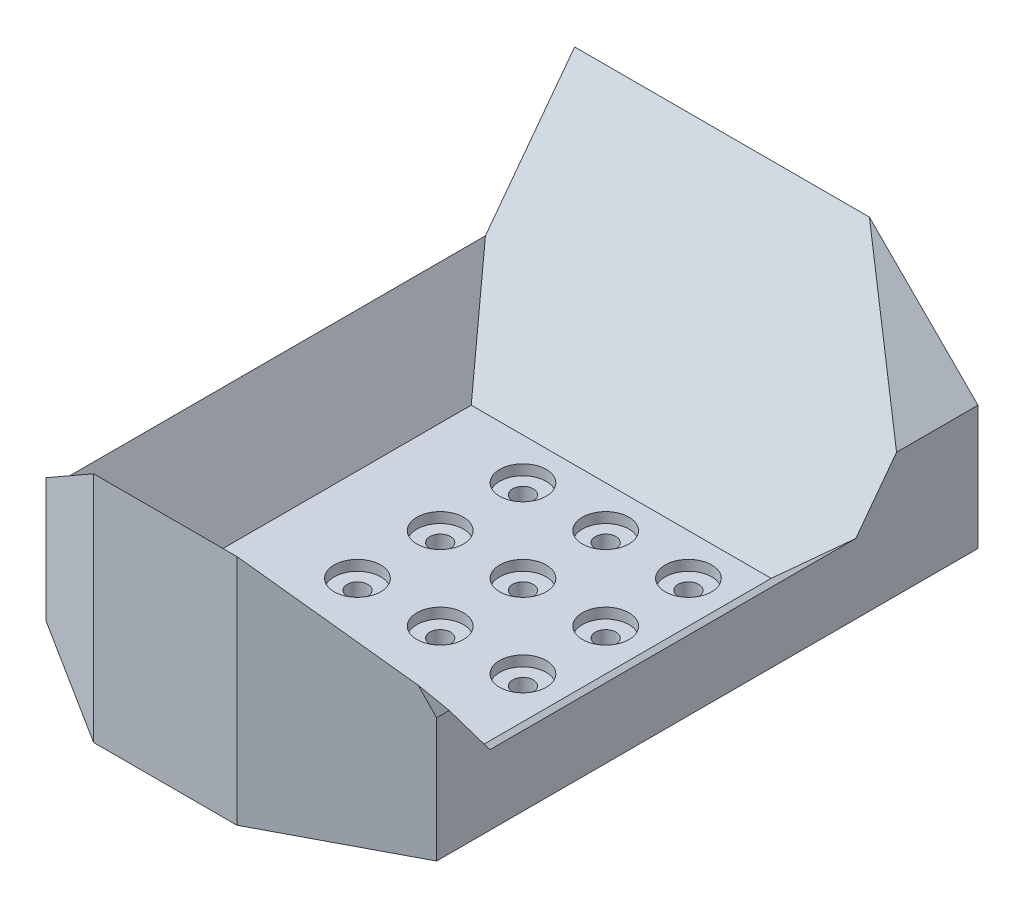
from build123d import *
from build123d.topology import SkipClean

# Parameters (mm, degrees)
SKETCH_1_W           = 62
SKETCH_1_H           = 62
EXTRUDE_1_DEPTH      = 19
SKETCH_4_W           = 58
SKETCH_4_H           = 58
CUT_EXTRUDE_1_DEPTH  = 17
SKETCH_5_W           = 8
SKETCH_5_H           = 62
EXTRUDE_2_DEPTH      = 19
SKETCH_7_W           = 58
SKETCH_7_H           = 17
CUT_EXTRUDE_2_DEPTH  = 19
CUT_EXTRUDE_3_DEPTH  = 108
SKETCH_9_W           = 70
SKETCH_9_H           = 2
EXTRUDE_3_DEPTH      = 28
SKETCH_10_W          = 70
SKETCH_10_H          = 28
EXTRUDE_4_DEPTH      = 40
CUT_EXTRUDE_5_DEPTH  = 90
SKETCH_14_W          = 60
SKETCH_14_H          = 62
CUT_EXTRUDE_6_DEPTH  = 17
SKETCH_15_W          = 62
SKETCH_15_H          = 2
EXTRUDE_6_DEPTH      = 8
SKETCH_18_W          = 10
SKETCH_18_H          = 62
EXTRUDE_8_DEPTH      = 19
CUT_EXTRUDE_7_DEPTH  = 62
EXTRUDE_9_DEPTH      = 8
SKETCH_23_W          = 78
SKETCH_23_H          = 2
EXTRUDE_13_DEPTH     = 28
SKETCH_25_W          = 78
SKETCH_25_H          = 28
EXTRUDE_14_DEPTH     = 40
CUT_EXTRUDE_8_DEPTH  = 99
EXTRUDE_19_DEPTH     = 78
EXTRUDE_20_DEPTH     = 78
EXTRUDE_21_DEPTH     = 24
EXTRUDE_22_DEPTH     = 24
EXTRUDE_23_DEPTH     = 24
EXTRUDE_24_DEPTH     = 24
SKETCH_43_W          = 78
SKETCH_43_H          = 118
EXTRUDE_25_DEPTH     = 1
CUT_EXTRUDE_14_DEPTH = 127
CUT_EXTRUDE_15_DEPTH = 80
SKETCH_49_R          = 2
CUT_EXTRUDE_17_DEPTH = 19
SKETCH_50_R          = 4.5
CUT_EXTRUDE_18_DEPTH = 2
SKETCH_55_R          = 2
CUT_EXTRUDE_20_DEPTH = 7.5
SKETCH_57_W          = 36.095465849
SKETCH_57_H          = 32.16378967
EXTRUDE_26_DEPTH     = 7
SKETCH_63_R          = 1.8
CUT_EXTRUDE_23_DEPTH = 7.5
SKETCH_64_W          = 78
SKETCH_64_H          = 118
EXTRUDE_27_DEPTH     = 1
SKETCH_65_R          = 2
CUT_EXTRUDE_24_DEPTH = 29
SKETCH_66_W          = 78
SKETCH_66_H          = 118
EXTRUDE_28_DEPTH     = 1
SKETCH_68_R          = 2
CUT_EXTRUDE_25_DEPTH = 28
CUT_EXTRUDE_26_DEPTH = 123.576506721
SKETCH_70_R          = 4
CUT_EXTRUDE_27_DEPTH = 5.5
CUT_EXTRUDE_28_REACH = 145.485


with BuildPart() as part:
    # 草圖1 → 填料-伸長1 (new body)
    with BuildSketch(Plane(origin=(0, 0, 0), x_dir=(1, 0, 0), z_dir=(0, 1, 0))):
        with Locations((31, 31)):
            Rectangle(SKETCH_1_W, SKETCH_1_H)
    extrude(amount=EXTRUDE_1_DEPTH)

    # 草圖4 → 除料-伸長1 (cut)
    with BuildSketch(Plane(origin=(0, 19, 0), x_dir=(1, 0, 0), z_dir=(0, 1, 0))):
        with Locations((31, 31)):
            Rectangle(SKETCH_4_W, SKETCH_4_H)
    extrude(amount=-CUT_EXTRUDE_1_DEPTH, mode=Mode.SUBTRACT)

    # 草圖5 → 填料-伸長2 (add)
    with BuildSketch(Plane(origin=(0, 19, 0), x_dir=(1, 0, 0), z_dir=(0, 1, 0))):
        with Locations((-4, 31)):
            Rectangle(SKETCH_5_W, SKETCH_5_H)
    extrude(amount=-EXTRUDE_2_DEPTH)

    # 草圖7 → 除料-伸長2 (cut)
    with BuildSketch(Plane.XY.offset(-60)):
        with Locations((31, 10.5)):
            Rectangle(SKETCH_7_W, SKETCH_7_H)
    extrude(amount=-CUT_EXTRUDE_2_DEPTH, mode=Mode.SUBTRACT)

    # 草圖8 → 除料-伸長3 (cut)
    with BuildSketch(Plane(origin=(0, 0, -62), x_dir=(-1, 0, 0), z_dir=(0, 0, -1))):
        Polygon((-2, 2), (8, 19), (-2, 19), align=None)
    extrude(amount=-CUT_EXTRUDE_3_DEPTH, mode=Mode.SUBTRACT)

    # 草圖9 → 填料-伸長3 (add)
    with BuildSketch(Plane(origin=(0, 0, -62), x_dir=(-1, 0, 0), z_dir=(0, 0, -1))):
        with Locations((-27, 1)):
            Rectangle(SKETCH_9_W, SKETCH_9_H)
    extrude(amount=EXTRUDE_3_DEPTH)

    # 草圖10 → 填料-伸長4 (add)
    with BuildSketch(Plane(origin=(0, 2, 0), x_dir=(1, 0, 0), z_dir=(0, 1, 0))):
        with Locations((27, 76)):
            Rectangle(SKETCH_10_W, SKETCH_10_H)
    extrude(amount=EXTRUDE_4_DEPTH)

    # 草圖11 → 除料-伸長5 (cut)
    with BuildSketch(Plane.ZY.offset(8)):
        Polygon((-62, 42), (-62, 2), (-90, 42), align=None)
    extrude(amount=-CUT_EXTRUDE_5_DEPTH, mode=Mode.SUBTRACT)

    # 草圖14 → 除料-伸長6 (cut)
    with BuildSketch(Plane(origin=(0, 19, 0), x_dir=(1, 0, 0), z_dir=(0, 1, 0))):
        with Locations((32, 31)):
            Rectangle(SKETCH_14_W, SKETCH_14_H)
    extrude(amount=-CUT_EXTRUDE_6_DEPTH, mode=Mode.SUBTRACT)

    # 草圖15 → 填料-伸長6 (add)
    with BuildSketch(Plane(origin=(62, 0, 0), x_dir=(0, 0, -1), z_dir=(1, 0, 0))):
        with Locations((31, 1)):
            Rectangle(SKETCH_15_W, SKETCH_15_H)
    extrude(amount=EXTRUDE_6_DEPTH)

    # 草圖18 → 填料-伸長8 (add)
    with BuildSketch(Plane(origin=(0, 2, 0), x_dir=(1, 0, 0), z_dir=(0, 1, 0))):
        with Locations((65, 31)):
            Rectangle(SKETCH_18_W, SKETCH_18_H)
    extrude(amount=EXTRUDE_8_DEPTH)

    # 草圖19 → 除料-伸長7 (cut)
    with BuildSketch(Plane.XY):
        Polygon((60, 2), (70, 10.5), (70, 21), (60, 21), align=None)
    extrude(amount=-CUT_EXTRUDE_7_DEPTH, mode=Mode.SUBTRACT)

    # 草圖20 → 填料-伸長9 (add)
    with BuildSketch(Plane(origin=(62, 0, 0), x_dir=(0, 0, -1), z_dir=(1, 0, 0))):
        Polygon((90, 42), (62, 2), (62, 0), (90, 0), align=None)
    extrude(amount=EXTRUDE_9_DEPTH)

    # 草圖23 → 填料-伸長13 (add)
    with BuildSketch(Plane.XY):
        with Locations((31, 1)):
            Rectangle(SKETCH_23_W, SKETCH_23_H)
    extrude(amount=EXTRUDE_13_DEPTH)

    # 草圖25 → 填料-伸長14 (add)
    with BuildSketch(Plane(origin=(0, 2, 0), x_dir=(1, 0, 0), z_dir=(0, 1, 0))):
        with Locations((31, -14)):
            Rectangle(SKETCH_25_W, SKETCH_25_H)
    extrude(amount=EXTRUDE_14_DEPTH)

    # 草圖26 → 除料-伸長8 (cut)
    with BuildSketch(Plane.ZY.offset(8)):
        Polygon((28, 42), (0, 42), (0, 2), align=None)
    extrude(amount=-CUT_EXTRUDE_8_DEPTH, mode=Mode.SUBTRACT)

    # 草圖34 → 填料-伸長19 (add)
    with BuildSketch(Plane(origin=(70, 0, 0), x_dir=(0, 0, -1), z_dir=(1, 0, 0))):
        Polygon((-28, 2), (0, 2), (-28, 42), align=None)
        Polygon((-28, 42), (0, 2), (0, 4.666666667), align=None)
        Polygon((0, 4.666666667), (0, 2), (2, 2), align=None)
    extrude(amount=-EXTRUDE_19_DEPTH)

    # 草圖36 → 填料-伸長20 (add)
    with BuildSketch(Plane.ZY.offset(8)):
        Polygon((-90, 2), (-62, 2), (-90, 42), align=None)
        Polygon((-90, 42), (-62, 2), (-62, 4.666666667), align=None)
        Polygon((-62, 4.666666667), (-62, 2), (-60, 2), align=None)
    extrude(amount=-EXTRUDE_20_DEPTH)

    # 草圖37 → 填料-伸長21 (add)
    with BuildSketch(Plane(origin=(0, 0, -62), x_dir=(-1, 0, 0), z_dir=(0, 0, -1))):
        Polygon((8, 4.666666667), (-0.431372549, 4.666666667), (8, 19), align=None)
    extrude(amount=EXTRUDE_21_DEPTH)

    # 草圖38 → 填料-伸長22 (add)
    with BuildSketch(Plane(origin=(0, 0, -62), x_dir=(-1, 0, 0), z_dir=(0, 0, -1))):
        Polygon((-63.137254902, 4.666666667), (-70, 4.666666667), (-70, 10.5), align=None)
    extrude(amount=EXTRUDE_22_DEPTH)

    # 草圖39 → 填料-伸長23 (add)
    with BuildSketch(Plane.XY):
        Polygon((-8, 19), (-8, 4.666666667), (0.431372549, 4.666666667), align=None)
    extrude(amount=EXTRUDE_23_DEPTH)

    # 草圖40 → 填料-伸長24 (add)
    with BuildSketch(Plane.XY):
        Polygon((70, 10.5), (63.137254902, 4.666666667), (70, 4.666666667), align=None)
    extrude(amount=EXTRUDE_24_DEPTH)

    # 草圖43 → 填料-伸長25 (add)
    with BuildSketch(Plane(origin=(0, 0, 0), x_dir=(-1, 0, 0), z_dir=(0, -1, 0))):
        with Locations((-31, 31)):
            Rectangle(SKETCH_43_W, SKETCH_43_H)
    extrude(amount=EXTRUDE_25_DEPTH)

    # 草圖46 → 除料-伸長14 (cut)
    with BuildSketch(Plane(origin=(0, 0, -90), x_dir=(-1, 0, 0), z_dir=(0, 0, -1))):
        Polygon((-70, 42), (-60, 42), (-70, 21), align=None)
    extrude(amount=-CUT_EXTRUDE_14_DEPTH, mode=Mode.SUBTRACT)

    # 草圖47 → 除料-伸長15 (cut)
    with BuildSketch(Plane.XY.offset(28)):
        Polygon((-8, 42), (2, 42), (-8, 21), align=None)
    extrude(amount=-CUT_EXTRUDE_15_DEPTH, mode=Mode.SUBTRACT)

    # 草圖49 → 除料-伸長17 (cut)
    with BuildSketch(Plane(origin=(0, 2, 0), x_dir=(1, 0, 0), z_dir=(0, 1, 0))):
        with Locations(Location((52, 52, 0), (0, 0, 270))):
            Circle(SKETCH_49_R)
        with Locations(Location((36, 52, 0), (0, 0, 270))):
            Circle(SKETCH_49_R)
        with Locations(Location((20, 52, 0), (0, 0, 270))):
            Circle(SKETCH_49_R)
        with Locations(Location((36, 36, 0), (0, 0, 270))):
            Circle(SKETCH_49_R)
        with Locations(Location((20, 36, 0), (0, 0, 270))):
            Circle(SKETCH_49_R)
        with Locations(Location((36, 20, 0), (0, 0, 270))):
            Circle(SKETCH_49_R)
        with Locations(Location((20, 20, 0), (0, 0, 270))):
            Circle(SKETCH_49_R)
        with Locations(Location((52, 36, 0), (0, 0, 270))):
            Circle(SKETCH_49_R)
        with Locations(Location((52, 20, 0), (0, 0, 270))):
            Circle(SKETCH_49_R)
    extrude(amount=-CUT_EXTRUDE_17_DEPTH, mode=Mode.SUBTRACT)

    # 草圖50 → 除料-伸長18 (cut)
    with BuildSketch(Plane(origin=(0, 2, 0), x_dir=(1, 0, 0), z_dir=(0, 1, 0))):
        with Locations(Location((52, 20, 0), (0, 0, 270))):
            Circle(SKETCH_50_R)
        with Locations(Location((36, 20, 0), (0, 0, 270))):
            Circle(SKETCH_50_R)
        with Locations(Location((20, 20, 0), (0, 0, 270))):
            Circle(SKETCH_50_R)
        with Locations(Location((36, 36, 0), (0, 0, 270))):
            Circle(SKETCH_50_R)
        with Locations(Location((20, 36, 0), (0, 0, 270))):
            Circle(SKETCH_50_R)
        with Locations(Location((36, 52, 0), (0, 0, 270))):
            Circle(SKETCH_50_R)
        with Locations(Location((20, 52, 0), (0, 0, 270))):
            Circle(SKETCH_50_R)
        with Locations(Location((52, 36, 0), (0, 0, 270))):
            Circle(SKETCH_50_R)
        with Locations(Location((52, 52, 0), (0, 0, 270))):
            Circle(SKETCH_50_R)
    extrude(amount=-CUT_EXTRUDE_18_DEPTH, mode=Mode.SUBTRACT)

    # 草圖55 → 除料-伸長20 (cut)
    with BuildSketch(Plane(origin=(0, 0, -90), x_dir=(-1, 0, 0), z_dir=(0, 0, -1))):
        with Locations((-5, 7)):
            Circle(SKETCH_55_R)
        with Locations((-13, 7)):
            Circle(SKETCH_55_R)
        with Locations((-5, 15)):
            Circle(SKETCH_55_R)
        with Locations((-13, 15)):
            Circle(SKETCH_55_R)
        with Locations((-5, 23)):
            Circle(SKETCH_55_R)
        with Locations((-13, 23)):
            Circle(SKETCH_55_R)
        with Locations((3, 15)):
            Circle(SKETCH_55_R)
        with Locations((3, 23)):
            Circle(SKETCH_55_R)
    extrude(amount=-CUT_EXTRUDE_20_DEPTH, mode=Mode.SUBTRACT)

    # 草圖57 → 填料-伸長26 (add)
    with SkipClean():  # the faces are left unmerged after this step: merging them gives an invalid solid
        with BuildSketch(Plane(origin=(0, 0, -90), x_dir=(-1, 0, 0), z_dir=(0, 0, -1))):
            with Locations((-10.047732924, 15.081894835)):
                Rectangle(SKETCH_57_W, SKETCH_57_H)
        extrude(amount=-EXTRUDE_26_DEPTH)

    # 草圖63 → 除料-伸長23 (cut)
    with SkipClean():  # the faces are left unmerged after this step: merging them gives an invalid solid
        with BuildSketch(Plane(origin=(0, 0, -90), x_dir=(-1, 0, 0), z_dir=(0, 0, -1))):
            with Locations((-64, 7)):
                Circle(SKETCH_63_R)
            with Locations((-56, 7)):
                Circle(SKETCH_63_R)
            with Locations((-48, 7)):
                Circle(SKETCH_63_R)
            with Locations((-56, 15)):
                Circle(SKETCH_63_R)
            with Locations((-48, 15)):
                Circle(SKETCH_63_R)
            with Locations((-56, 23)):
                Circle(SKETCH_63_R)
            with Locations((-48, 23)):
                Circle(SKETCH_63_R)
            with Locations((-64, 15)):
                Circle(SKETCH_63_R)
            with Locations((-64, 23)):
                Circle(SKETCH_63_R)
        extrude(amount=-CUT_EXTRUDE_23_DEPTH, mode=Mode.SUBTRACT)

    # 草圖64 → 填料-伸長27 (add)
    with SkipClean():  # the faces are left unmerged after this step: merging them gives an invalid solid
        with BuildSketch(Plane(origin=(0, -1, 0), x_dir=(-1, 0, 0), z_dir=(0, -1, 0))):
            with Locations((-31, 31)):
                Rectangle(SKETCH_64_W, SKETCH_64_H)
        extrude(amount=EXTRUDE_27_DEPTH)

    # 草圖65 → 除料-伸長24 (cut)
    with SkipClean():  # the faces are left unmerged after this step: merging them gives an invalid solid
        with BuildSketch(Plane(origin=(0, -1, 0), x_dir=(1, 0, 0), z_dir=(0, 1, 0))):
            with Locations(Location((52, 52, 0), (0, 0, 270))):
                Circle(SKETCH_65_R)
            with Locations(Location((36, 52, 0), (0, 0, 270))):
                Circle(SKETCH_65_R)
            with Locations(Location((20, 52, 0), (0, 0, 270))):
                Circle(SKETCH_65_R)
            with Locations(Location((36, 36, 0), (0, 0, 270))):
                Circle(SKETCH_65_R)
            with Locations(Location((20, 36, 0), (0, 0, 270))):
                Circle(SKETCH_65_R)
            with Locations(Location((36, 20, 0), (0, 0, 270))):
                Circle(SKETCH_65_R)
            with Locations(Location((20, 20, 0), (0, 0, 270))):
                Circle(SKETCH_65_R)
            with Locations(Location((52, 36, 0), (0, 0, 270))):
                Circle(SKETCH_65_R)
            with Locations(Location((52, 20, 0), (0, 0, 270))):
                Circle(SKETCH_65_R)
        extrude(amount=-CUT_EXTRUDE_24_DEPTH, mode=Mode.SUBTRACT)

    # 草圖66 → 填料-伸長28 (add)
    with SkipClean():  # the faces are left unmerged after this step: merging them gives an invalid solid
        with BuildSketch(Plane(origin=(0, -2, 0), x_dir=(-1, 0, 0), z_dir=(0, -1, 0))):
            with Locations((-31, 31)):
                Rectangle(SKETCH_66_W, SKETCH_66_H)
        extrude(amount=EXTRUDE_28_DEPTH)

    # 草圖68 → 除料-伸長25 (cut)
    with SkipClean():  # the faces are left unmerged after this step: merging them gives an invalid solid
        with BuildSketch(Plane(origin=(0, -2, 0), x_dir=(1, 0, 0), z_dir=(0, 1, 0))):
            with Locations(Location((20, 20, 0), (0, 0, 270))):
                Circle(SKETCH_68_R)
            with Locations(Location((36, 20, 0), (0, 0, 270))):
                Circle(SKETCH_68_R)
            with Locations(Location((52, 20, 0), (0, 0, 270))):
                Circle(SKETCH_68_R)
            with Locations(Location((36, 36, 0), (0, 0, 270))):
                Circle(SKETCH_68_R)
            with Locations(Location((52, 36, 0), (0, 0, 270))):
                Circle(SKETCH_68_R)
            with Locations(Location((36, 52, 0), (0, 0, 270))):
                Circle(SKETCH_68_R)
            with Locations(Location((52, 52, 0), (0, 0, 270))):
                Circle(SKETCH_68_R)
            with Locations(Location((20, 36, 0), (0, 0, 270))):
                Circle(SKETCH_68_R)
            with Locations(Location((20, 52, 0), (0, 0, 270))):
                Circle(SKETCH_68_R)
        extrude(amount=-CUT_EXTRUDE_25_DEPTH, mode=Mode.SUBTRACT)

    # 草圖69 → 除料-伸長26 (cut, through all)
    with SkipClean():  # the faces are left unmerged after this step: merging them gives an invalid solid
        with BuildSketch(Plane.XZ.offset(3)):
            Polygon((44.688398055, 28), (70, 14.695963205), (70, 28), align=None)
            Polygon((-8, 12.228780626), (-8, 28), (16.973529168, 28), align=None)
        extrude(amount=-CUT_EXTRUDE_26_DEPTH, mode=Mode.SUBTRACT)

    # 草圖70 → 除料-伸長27 (cut)
    with SkipClean():  # the faces are left unmerged after this step: merging them gives an invalid solid
        with BuildSketch(Plane.XZ.offset(3)):
            with Locations((44.846502364, -75.034640188)):
                Circle(SKETCH_70_R)
            with Locations((38.08240333, -79.306286739)):
                Circle(SKETCH_70_R)
            with Locations((21.848565648, -89.558238461)):
                Circle(SKETCH_70_R)
            with BuildLine():
                Line((46.98232564, -78.416689705), (40.218226606, -82.688336256))
                ThreePointArc((40.218226606, -82.688336256), (34.700353813, -81.442110014), (35.946580055, -75.924237222))
                Line((35.946580055, -75.924237222), (42.710679089, -71.652590671))
                ThreePointArc((42.710679089, -71.652590671), (48.228551881, -72.898816913), (46.98232564, -78.416689705))
            make_face()
        extrude(amount=-CUT_EXTRUDE_27_DEPTH, mode=Mode.SUBTRACT)

    # 草圖71 → 除料-伸長28 (cut, up to next)
    with BuildSketch(Plane(origin=(0, 0, -90), x_dir=(-1, 0, 0), z_dir=(0, 0, -1)), mode=Mode.PRIVATE) as cut_extrude_28_sk1:
        Polygon((-70, 21), (-60, 42), (-49, 42), align=None)
    cut_extrude_28_tool1 = extrude(cut_extrude_28_sk1.sketch, amount=-CUT_EXTRUDE_28_REACH, mode=Mode.PRIVATE) & part.part
    add(cut_extrude_28_tool1.solids().sort_by_distance((59.666667, 35, -90))[0], mode=Mode.SUBTRACT)


solid = part.part
